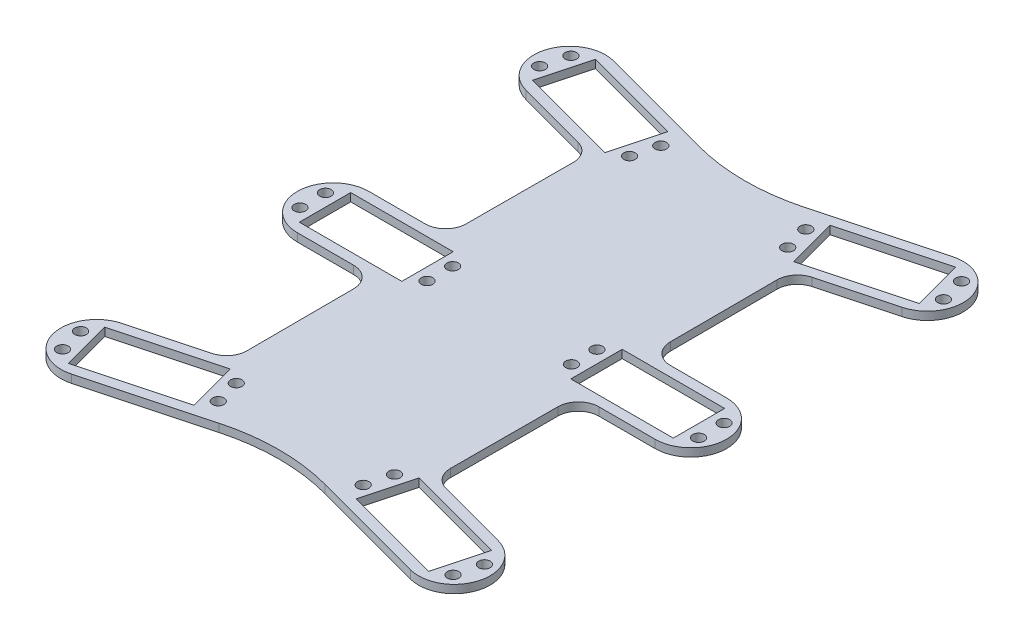
from build123d import *

# Parameters (mm, degrees)
SKETCH1_R           = 2.25
SKETCH1_W           = 40.1
SKETCH1_H           = 20.1
BOSS_EXTRUDE1_DEPTH = 3.175
FILLET1_R           = 80
FILLET2_R           = 8


with BuildPart() as part:
    # Sketch1 → Boss-Extrude1 (new body)
    with BuildSketch(Plane(origin=(0, 0, 0), x_dir=(1, 0, 0), z_dir=(0, 1, 0))):
        with BuildLine():
            Line((-70, 14), (-40, 14))
            Line((-40, 14), (-39.816062711, 70))
            Line((-39.816062711, 70), (-73.623466631, 79.058666579))
            ThreePointArc((-73.623466631, 79.058666579), (-83.522961568, 96.205094778), (-66.376533369, 106.104589715))
            Line((-66.376533369, 106.104589715), (0, 88.319051202))
            Line((0, 88.319051202), (66.376533369, 106.104589715))
            ThreePointArc((66.376533369, 106.104589715), (83.522961568, 96.205094778), (73.623466631, 79.058666579))
            Line((73.623466631, 79.058666579), (39.816062711, 70))
            Line((39.816062711, 70), (40, 14))
            Line((40, 14), (70, 14))
            ThreePointArc((70, 14), (84, 0), (70, -14))
            Line((70, -14), (40, -14))
            Line((40, -14), (39.816062711, -70))
            Line((39.816062711, -70), (73.623466631, -79.058666579))
            ThreePointArc((73.623466631, -79.058666579), (83.522961568, -96.205094778), (66.376533369, -106.104589715))
            Line((66.376533369, -106.104589715), (0, -88.319051202))
            Line((0, -88.319051202), (-66.376533369, -106.104589715))
            ThreePointArc((-66.376533369, -106.104589715), (-83.522961568, -96.205094778), (-73.623466631, -79.058666579))
            Line((-73.623466631, -79.058666579), (-39.816062711, -70))
            Line((-39.816062711, -70), (-40, -14))
            Line((-40, -14), (-70, -14))
            ThreePointArc((-70, -14), (-84, 0), (-70, 14))
        make_face()
        with Locations(Location((-76.433311385, 99.481809639, 0), (0, 0, 270))):
            Circle(SKETCH1_R, mode=Mode.SUBTRACT)
        with Locations(Location((-79.021501836, 89.822551376, 0), (0, 0, 270))):
            Circle(SKETCH1_R, mode=Mode.SUBTRACT)
        with Locations(Location((-78, 5, 0), (0, 0, 270))):
            Circle(SKETCH1_R, mode=Mode.SUBTRACT)
        with Locations(Location((-79.021501836, -89.822551376, 0), (0, 0, 90))):
            Circle(SKETCH1_R, mode=Mode.SUBTRACT)
        with Locations(Location((-76.433311385, -99.481809639, 0), (0, 0, 90))):
            Circle(SKETCH1_R, mode=Mode.SUBTRACT)
        with Locations(Location((-78, -5, 0), (0, 0, 270))):
            Circle(SKETCH1_R, mode=Mode.SUBTRACT)
        with Locations(Location((78, -5, 0), (0, 0, 90))):
            Circle(SKETCH1_R, mode=Mode.SUBTRACT)
        with Locations(Location((76.433311385, -99.481809639, 0), (0, 0, 270))):
            Circle(SKETCH1_R, mode=Mode.SUBTRACT)
        with Locations(Location((79.021501836, -89.822551376, 0), (0, 0, 270))):
            Circle(SKETCH1_R, mode=Mode.SUBTRACT)
        with Locations(Location((78, 5, 0), (0, 0, 90))):
            Circle(SKETCH1_R, mode=Mode.SUBTRACT)
        with Locations(Location((79.021501836, 89.822551376, 0), (0, 0, 90))):
            Circle(SKETCH1_R, mode=Mode.SUBTRACT)
        with Locations(Location((76.433311385, 99.481809639, 0), (0, 0, 90))):
            Circle(SKETCH1_R, mode=Mode.SUBTRACT)
        with Locations(Location((-30.95703272, 76.943715692, 0), (0, 0, 90))):
            Circle(SKETCH1_R, mode=Mode.SUBTRACT)
        with Locations(Location((-28.368842269, 86.602973955, 0), (0, 0, 90))):
            Circle(SKETCH1_R, mode=Mode.SUBTRACT)
        with Locations(Location((-28.24, -5, 0), (0, 0, 90))):
            Circle(SKETCH1_R, mode=Mode.SUBTRACT)
        with Locations(Location((-28.24, 5, 0), (0, 0, 90))):
            Circle(SKETCH1_R, mode=Mode.SUBTRACT)
        with Locations(Location((-28.368842269, -86.602973955, 0), (0, 0, 270))):
            Circle(SKETCH1_R, mode=Mode.SUBTRACT)
        with Locations(Location((-30.95703272, -76.943715692, 0), (0, 0, 270))):
            Circle(SKETCH1_R, mode=Mode.SUBTRACT)
        with Locations(Location((28.368842269, 86.602973955, 0), (0, 0, 270))):
            Circle(SKETCH1_R, mode=Mode.SUBTRACT)
        with Locations(Location((30.95703272, 76.943715692, 0), (0, 0, 270))):
            Circle(SKETCH1_R, mode=Mode.SUBTRACT)
        with Locations(Location((28.24, 5, 0), (0, 0, 270))):
            Circle(SKETCH1_R, mode=Mode.SUBTRACT)
        with Locations(Location((28.24, -5, 0), (0, 0, 270))):
            Circle(SKETCH1_R, mode=Mode.SUBTRACT)
        with Locations(Location((30.95703272, -76.943715692, 0), (0, 0, 90))):
            Circle(SKETCH1_R, mode=Mode.SUBTRACT)
        with Locations(Location((28.368842269, -86.602973955, 0), (0, 0, 90))):
            Circle(SKETCH1_R, mode=Mode.SUBTRACT)
        Polygon((-70.460853466, 103.109639074), (-75.663116273, 83.694529965), (-36.929490638, 73.315886257), (-31.727227832, 92.730995365), align=None, mode=Mode.SUBTRACT)
        with Locations((-53.12, 0)):
            Rectangle(SKETCH1_W, SKETCH1_H, mode=Mode.SUBTRACT)
        Polygon((-36.929490638, -73.315886257), (-31.727227832, -92.730995365), (-70.460853466, -103.109639074), (-75.663116273, -83.694529965), align=None, mode=Mode.SUBTRACT)
        Polygon((36.929490638, 73.315886257), (31.727227832, 92.730995365), (70.460853466, 103.109639074), (75.663116273, 83.694529965), align=None, mode=Mode.SUBTRACT)
        with Locations((53.12, 0)):
            Rectangle(SKETCH1_W, SKETCH1_H, mode=Mode.SUBTRACT)
        Polygon((36.929490638, -73.315886257), (31.727227832, -92.730995365), (70.460853466, -103.109639074), (75.663116273, -83.694529965), align=None, mode=Mode.SUBTRACT)
    extrude(amount=BOSS_EXTRUDE1_DEPTH)

    # Fillet1
    fillet1_edges = [part.edges().sort_by_distance(p)[0] for p in [
        (0, 1.5875, -88.319051202),
        (0, 1.5875, 88.319051202),
    ]]
    fillet(fillet1_edges, radius=FILLET1_R)

    # Fillet2
    fillet2_edges = [part.edges().sort_by_distance(p)[0] for p in [
        (-40, 1.5875, -14),
        (-39.816062711, 1.5875, -70),
        (39.816062711, 1.5875, -70),
        (40, 1.5875, -14),
        (40, 1.5875, 14),
        (39.816062711, 1.5875, 70),
        (-39.816062711, 1.5875, 70),
        (-40, 1.5875, 14),
    ]]
    fillet(fillet2_edges, radius=FILLET2_R)


solid = part.part
